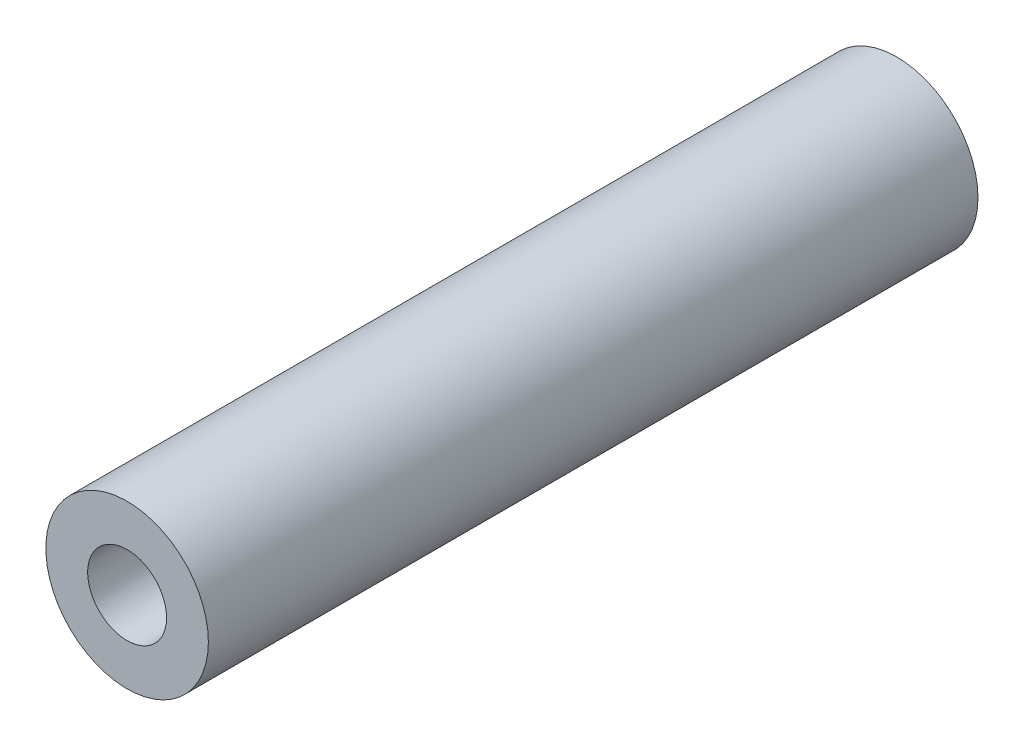
from build123d import *

# Parameters (mm, degrees)
M3_CLEARANCE_PROFILE_R   = 3.4
M3_CLEARANCE_PROFILE_R_2 = 1.65
M3_CLEARANCE_DEPTH       = 32.2


with BuildPart() as part:
    # M3 clearance profile → M3 clearance (new body)
    with BuildSketch(Plane.XY):
        Circle(M3_CLEARANCE_PROFILE_R)
        Circle(M3_CLEARANCE_PROFILE_R_2, mode=Mode.SUBTRACT)
    extrude(amount=M3_CLEARANCE_DEPTH)


solid = part.part
